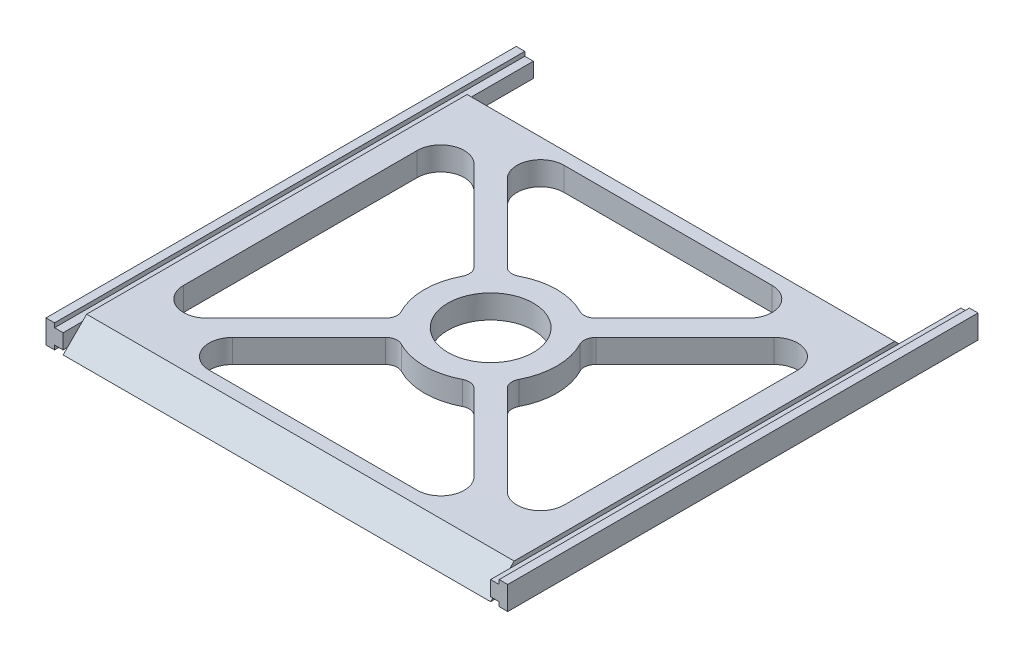
from build123d import *

# Parameters (mm, degrees)
BOSS_EXTRUDE1_DEPTH = 5.5
SKETCH4_W           = 2
SKETCH4_H           = 1
CUT_EXTRUDE2_DEPTH  = 110
SKETCH5_R           = 10
CUT_EXTRUDE3_DEPTH  = 110
CUT_EXTRUDE4_START  = -4
CUT_EXTRUDE4_DEPTH  = 100
FILLET3_R           = 5.5
FILLET4_R           = 2.75


with BuildPart() as part:
    # Sketch1 → Boss-Extrude1 (new body)
    with BuildSketch(Plane(origin=(0, 0, 0), x_dir=(1, 0, 0), z_dir=(0, 1, 0))):
        Polygon((0, 110), (4, 110), (4, 100), (104, 100), (104, 110), (108, 110), (108, 0), (0, 0), align=None)
    extrude(amount=BOSS_EXTRUDE1_DEPTH)

    # Sketch4 → Cut-Extrude2 (cut)
    with BuildSketch(Plane(origin=(0, 0, -110), x_dir=(-1, 0, 0), z_dir=(0, 0, -1))):
        with Locations((-3, 0.5)):
            Rectangle(SKETCH4_W, SKETCH4_H)
        with Locations((-3, 5)):
            Rectangle(SKETCH4_W, SKETCH4_H)
        with Locations((-105, 5)):
            Rectangle(SKETCH4_W, SKETCH4_H)
        with Locations((-105, 0.5)):
            Rectangle(SKETCH4_W, SKETCH4_H)
    extrude(amount=-CUT_EXTRUDE2_DEPTH, mode=Mode.SUBTRACT)

    # Sketch5 → Cut-Extrude3 (cut)
    with BuildSketch(Plane(origin=(0, 5.5, 0), x_dir=(1, 0, 0), z_dir=(0, 1, 0))):
        with Locations(Location((54, 50, 0), (0, 0, 270))):
            Circle(SKETCH5_R)
        with BuildLine():
            Line((41.269180349, 41.158267646), (9.5, 9.389087297))
            Line((9.5, 9.389087297), (9.5, 90.610912703))
            Line((9.5, 90.610912703), (41.269180349, 58.841732354))
            ThreePointArc((41.269180349, 58.841732354), (38.5, 50), (41.269180349, 41.158267646))
        make_face()
        with BuildLine():
            Line((98.5, 90.610912703), (98.5, 9.389087297))
            Line((98.5, 9.389087297), (66.730819651, 41.158267646))
            ThreePointArc((66.730819651, 41.158267646), (69.5, 50), (66.730819651, 58.841732354))
            Line((66.730819651, 58.841732354), (98.5, 90.610912703))
        make_face()
        with BuildLine():
            Line((45.158267646, 62.730819651), (16.389087297, 91.5))
            Line((16.389087297, 91.5), (91.610912703, 91.5))
            Line((91.610912703, 91.5), (62.841732354, 62.730819651))
            ThreePointArc((62.841732354, 62.730819651), (54, 65.5), (45.158267646, 62.730819651))
        make_face()
        with BuildLine():
            Line((16.389087297, 8.5), (91.610912703, 8.5))
            Line((91.610912703, 8.5), (62.841732354, 37.269180349))
            ThreePointArc((62.841732354, 37.269180349), (54, 34.5), (45.158267646, 37.269180349))
            Line((45.158267646, 37.269180349), (16.389087297, 8.5))
        make_face()
    extrude(amount=-CUT_EXTRUDE3_DEPTH, mode=Mode.SUBTRACT)

    # Sketch6 → Cut-Extrude4 (cut)
    with BuildSketch(Plane(origin=(108, 0, 0), x_dir=(0, 0, -1), z_dir=(1, 0, 0)).offset(CUT_EXTRUDE4_START)):
        Polygon((0, 0), (5.5, 5.5), (0, 5.5), align=None)
        Polygon((100, 5.5), (100, 0), (94.5, 5.5), align=None)
    extrude(amount=-CUT_EXTRUDE4_DEPTH, mode=Mode.SUBTRACT)

    # Fillet3
    fillet3_edges = [part.edges().sort_by_distance(p)[0] for p in [
        (16.389087297, 2.75, -91.5),
        (91.610912703, 2.75, -91.5),
        (9.5, 2.75, -9.389087297),
        (9.5, 2.75, -90.610912703),
        (98.5, 2.75, -90.610912703),
        (98.5, 2.75, -9.389087297),
        (16.389087297, 2.75, -8.5),
        (91.610912703, 2.75, -8.5),
    ]]
    fillet(fillet3_edges, radius=FILLET3_R)

    # Fillet4
    fillet4_edges = [part.edges().sort_by_distance(p)[0] for p in [
        (62.841732354, 2.75, -62.730819651),
        (45.158267646, 2.75, -62.730819651),
        (41.269180349, 2.75, -58.841732354),
        (41.269180349, 2.75, -41.158267646),
        (66.730819651, 2.75, -41.158267646),
        (66.730819651, 2.75, -58.841732354),
        (45.158267646, 2.75, -37.269180349),
        (62.841732354, 2.75, -37.269180349),
    ]]
    fillet(fillet4_edges, radius=FILLET4_R)


solid = part.part
